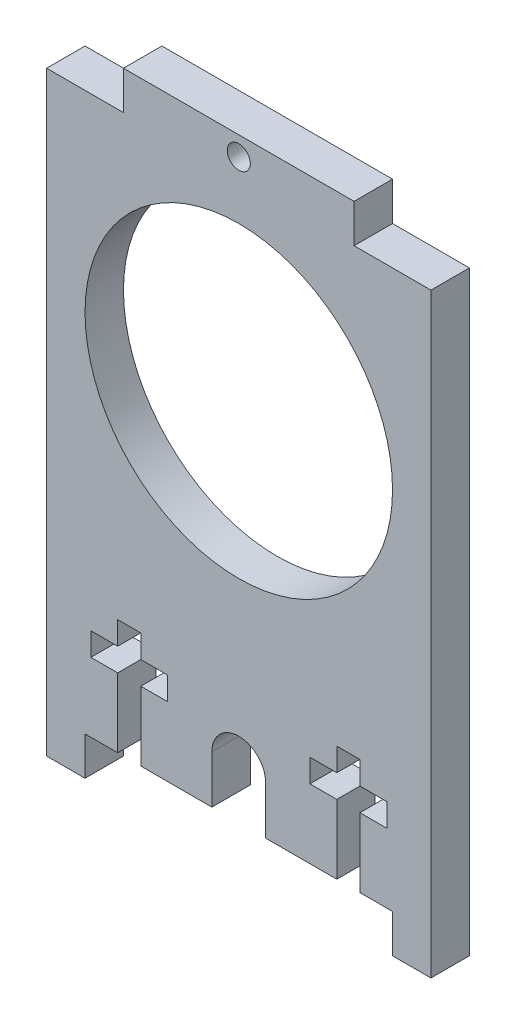
from build123d import *

# Parameters (mm, degrees)
CROQUIS1_R              = 1.5
CROQUIS1_R_2            = 20
SALIENTE_EXTRUIR1_DEPTH = 5


with BuildPart() as part:
    # Croquis1 → Saliente-Extruir1 (new body)
    with BuildSketch(Plane.XY):
        with BuildLine():
            Line((0, 0), (5, 0))
            Line((5, 0), (5, 5))
            Line((5, 5), (9.25, 5))
            Line((9.25, 5), (9.25, 14))
            Line((9.25, 14), (5.75, 14))
            Line((5.75, 14), (5.75, 17))
            Line((5.75, 17), (9.25, 17))
            Line((9.25, 17), (9.25, 20))
            Line((9.25, 20), (12.25, 20))
            Line((12.25, 20), (12.25, 17))
            Line((12.25, 17), (15.75, 17))
            Line((15.75, 17), (15.75, 14))
            Line((15.75, 14), (12.25, 14))
            Line((12.25, 14), (12.25, 5))
            Line((12.25, 5), (21.5, 5))
            Line((21.5, 5), (21.5, 11.24))
            ThreePointArc((21.5, 11.24), (25, 14.74), (28.5, 11.24))
            Line((28.5, 11.24), (28.5, 5))
            Line((28.5, 5), (37.75, 5))
            Line((37.75, 5), (37.75, 14))
            Line((37.75, 14), (34.25, 14))
            Line((34.25, 14), (34.25, 17))
            Line((34.25, 17), (37.75, 17))
            Line((37.75, 17), (37.75, 20))
            Line((37.75, 20), (40.75, 20))
            Line((40.75, 20), (40.75, 17))
            Line((40.75, 17), (44.25, 17))
            Line((44.25, 17), (44.25, 14))
            Line((44.25, 14), (40.75, 14))
            Line((40.75, 14), (40.75, 5))
            Line((40.75, 5), (45, 5))
            Line((45, 5), (45, 0))
            Line((45, 0), (50, 0))
            Line((50, 0), (50, 77.5))
            Line((50, 77.5), (40, 77.5))
            Line((40, 77.5), (40, 82.5))
            Line((40, 82.5), (10, 82.5))
            Line((10, 82.5), (10, 77.5))
            Line((10, 77.5), (0, 77.5))
            Line((0, 77.5), (0, 0))
        make_face()
        with Locations((25, 80)):
            Circle(CROQUIS1_R, mode=Mode.SUBTRACT)
        with Locations((25, 52.5)):
            Circle(CROQUIS1_R_2, mode=Mode.SUBTRACT)
    extrude(amount=SALIENTE_EXTRUIR1_DEPTH)


solid = part.part
